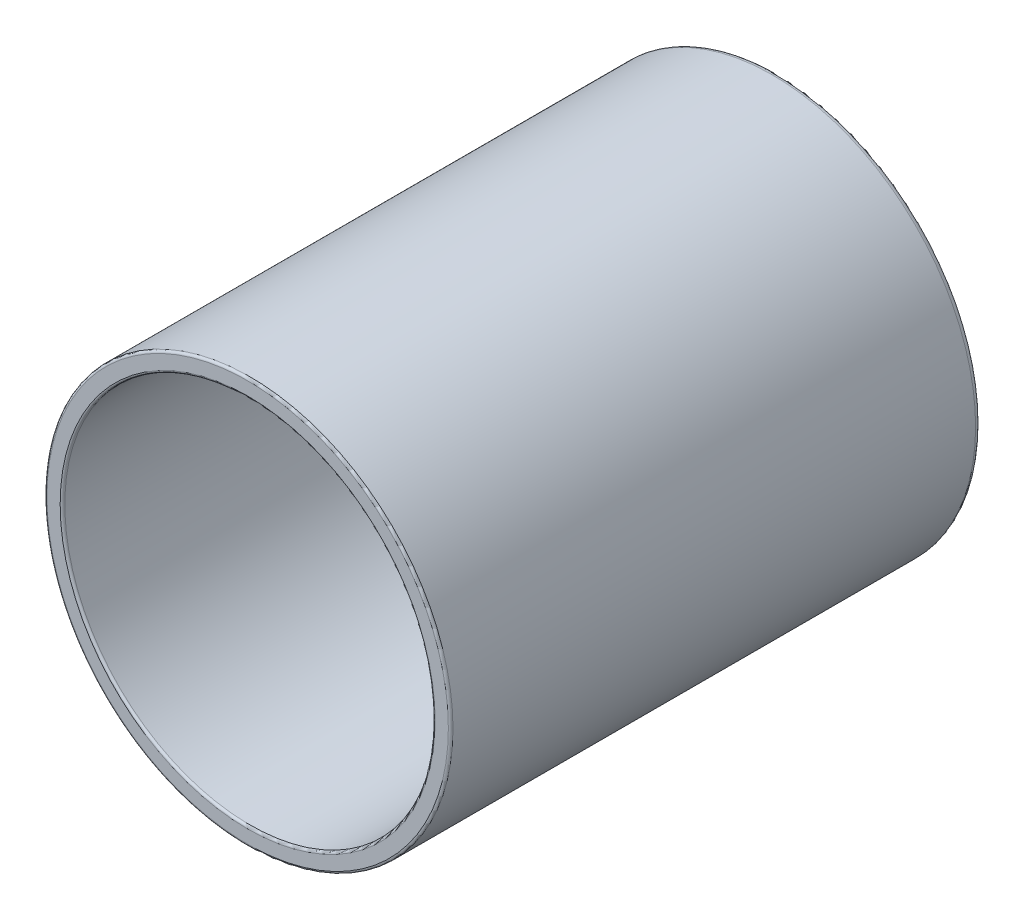
from build123d import *

# Parameters (mm, degrees)
ESQUISSE1_R        = 8.76
BOSS_EXTRU_1_DEPTH = 22.9
COQUE1_T           = -0.77
CONG_1_R           = 0.25
CONG_2_R           = 0.25
CONG_3_R           = 0.1


with BuildPart() as part:
    # Esquisse1 → Boss.-Extru.1 (new body)
    with BuildSketch(Plane.XY):
        with Locations((-3.305589664, 2.980219473)):
            Circle(ESQUISSE1_R)
    extrude(amount=BOSS_EXTRU_1_DEPTH)

    # Coque1
    coque1_openings = [part.faces().sort_by_distance(p)[0] for p in [
        (-3.305589664, 2.980219473, 22.9),
    ]]
    offset(amount=COQUE1_T, openings=coque1_openings, kind=Kind.INTERSECTION)

    # Congé1
    cong_1_edges = [part.edges().sort_by_distance(p)[0] for p in [
        (-11.295589664, 2.980219473, 0.77),
    ]]
    fillet(cong_1_edges, radius=CONG_1_R)

    # Congé2
    cong_2_edges = [part.edges().sort_by_distance(p)[0] for p in [
        (-12.065589664, 2.980219473, 0),
    ]]
    fillet(cong_2_edges, radius=CONG_2_R)

    # Congé3
    cong_3_edges = [part.edges().sort_by_distance(p)[0] for p in [
        (-12.065589664, 2.980219473, 22.9),
        (-11.295589664, 2.980219473, 22.9),
    ]]
    fillet(cong_3_edges, radius=CONG_3_R)


solid = part.part
